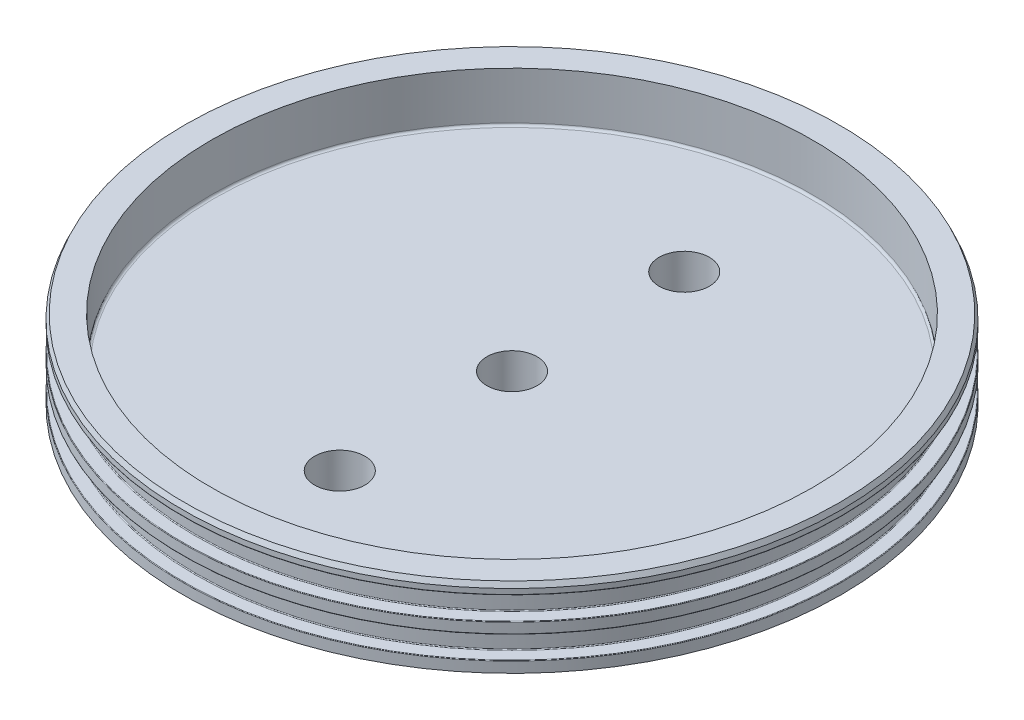
from build123d import *

# Parameters (mm, degrees)
SKETCH6_R                                = 66.04
BOSS_EXTRUDE1_DEPTH                      = 2.54
PIPE_TAP_DRILL_FOR_1_4_TAP_GN2_D         = 11.1252
CNC_ID_FILLET_R                          = 0.1778
CNC_OD_FILLET_R                          = 0.127
CNC_CHAMFERS_SIZE                        = 0.508
CNC_CHAMFERS_SIZE2                       = 1.089409516
CNC_BORE_FILLET_R                        = 0.508
PIPE_TAP_DRILL_FOR_1_4_TAP_RELIEF_VALV_D = 11.1252
PIPE_TAP_DRILL_FOR_1_4_TAP_VENT_VALVE_D  = 11.1252


with BuildPart() as part:
    # Sketch1 → Revolve1 (revolve)
    with BuildSketch(Plane.XY, mode=Mode.PRIVATE) as revolve1_sk:
        Polygon((0, 0), (72.898, 0), (72.898, 2.4638), (69.977, 2.4638), (69.977, 7.4422), (72.898, 7.4422), (72.898, 9.906), (69.977, 9.906), (69.977, 14.986), (72.898, 14.986), (72.898, 17.3482), (66.548, 17.3482), (66.548, 6.35), (0, 6.35), align=None)
    revolve(revolve1_sk.sketch.rotate(Axis((0, 48.192213231, 0), (0, -1, 0)), 180), axis=Axis((0, 48.192213231, 0), (0, -1, 0)))

    # Sketch6 → Boss-Extrude1 (add)
    with BuildSketch(Plane.XZ):
        Circle(SKETCH6_R)
    extrude(amount=BOSS_EXTRUDE1_DEPTH)

    # Pipe Tap Drill for 1/4 Tap - GN2 (through all)
    with Locations(Plane(origin=(0, 6.35, 0), x_dir=(1, 0, 0), z_dir=(0, 1, 0))):
        with Locations((0, 0)):
            Hole(PIPE_TAP_DRILL_FOR_1_4_TAP_GN2_D / 2)

    # CNC ID Fillet
    cnc_id_fillet_edges = [part.edges().sort_by_distance(p)[0] for p in [
        (69.977, 14.986, 0),
        (69.977, 9.906, 0),
        (69.977, 7.4422, 0),
        (69.977, 2.4638, 0),
        (-66.04, 0, 0),
    ]]
    fillet(cnc_id_fillet_edges, radius=CNC_ID_FILLET_R)

    # CNC OD Fillet
    cnc_od_fillet_edges = [part.edges().sort_by_distance(p)[0] for p in [
        (72.898, 14.986, 0),
        (72.898, 9.906, 0),
        (72.898, 7.4422, 0),
        (72.898, 2.4638, 0),
        (-66.04, -2.54, 0),
    ]]
    fillet(cnc_od_fillet_edges, radius=CNC_OD_FILLET_R)

    # CNC Chamfers
    cnc_chamfers_edges = [part.edges().sort_by_distance(p)[0] for p in [
        (72.898, 17.3482, 0),
    ]]
    cnc_chamfers_side = [part.faces().sort_by_distance(p)[0] for p in [
        (70.836133195, 17.3482, 0),
    ]]
    chamfer(cnc_chamfers_edges, length=CNC_CHAMFERS_SIZE, length2=CNC_CHAMFERS_SIZE2, reference=cnc_chamfers_side[0])

    # CNC Bore Fillet
    cnc_bore_fillet_edges = [part.edges().sort_by_distance(p)[0] for p in [
        (66.548, 6.35, 0),
    ]]
    fillet(cnc_bore_fillet_edges, radius=CNC_BORE_FILLET_R)

    # Pipe Tap Drill for 1/4 Tap - Relief Valve (through all)
    with Locations(Plane(origin=(0, -2.54, 0), x_dir=(-1, 0, 0), z_dir=(0, -1, 0))):
        with Locations((0, 38.1)):
            Hole(PIPE_TAP_DRILL_FOR_1_4_TAP_RELIEF_VALV_D / 2)

    # Pipe Tap Drill for 1/4 Tap - Vent Valve (through all)
    with Locations(Plane(origin=(0, -2.54, 0), x_dir=(-1, 0, 0), z_dir=(0, -1, 0))):
        with Locations((0, -38.1)):
            Hole(PIPE_TAP_DRILL_FOR_1_4_TAP_VENT_VALVE_D / 2)


solid = part.part
